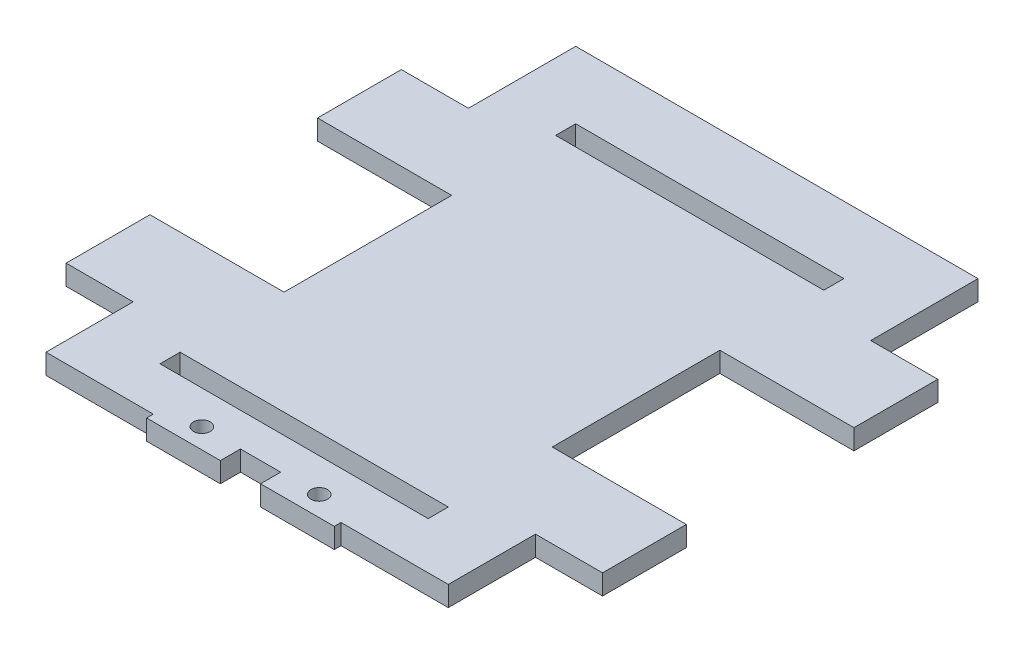
from build123d import *

# Parameters (mm, degrees)
SKETCH1_W           = 40
SKETCH1_H           = 3
BOSS_EXTRUDE1_DEPTH = 3
SKETCH2_R           = 1.25
CUT_EXTRUDE1_DEPTH  = 10
SKETCH3_W           = 16
SKETCH3_H           = 3
SKETCH3_W_2         = 11
SKETCH3_H_2         = 2.000440009
CUT_EXTRUDE2_DEPTH  = 10


with BuildPart() as part:
    # Sketch1 → Boss-Extrude1 (new body)
    with BuildSketch(Plane(origin=(0, 0, 0), x_dir=(1, 0, 0), z_dir=(0, 1, 0))):
        Polygon((20, 37.5), (20, 12.5), (0, 12.5), (0, 0), (10, 0), (10, -16), (70, -16), (70, 0), (80, 0), (80, 12.5), (60, 12.5), (60, 37.5), (80, 37.5), (80, 50), (70, 50), (70, 66), (10, 66), (10, 50), (0, 50), (0, 37.5), align=None)
        with Locations((40, -4.5)):
            Rectangle(SKETCH1_W, SKETCH1_H, mode=Mode.SUBTRACT)
        with Locations((40, 54.5)):
            Rectangle(SKETCH1_W, SKETCH1_H, mode=Mode.SUBTRACT)
    extrude(amount=BOSS_EXTRUDE1_DEPTH)

    # Sketch2 → Cut-Extrude1 (cut)
    with BuildSketch(Plane(origin=(0, 0, 0), x_dir=(1, 0, 0), z_dir=(0, 1, 0))):
        with Locations(Location((31.25, -11, 0), (0, 0, 270))):
            Circle(SKETCH2_R)
        with Locations(Location((48.75, -11, 0), (0, 0, 270))):
            Circle(SKETCH2_R)
    extrude(amount=CUT_EXTRUDE1_DEPTH, mode=Mode.SUBTRACT)

    # Sketch3 → Cut-Extrude2 (cut)
    with BuildSketch(Plane(origin=(0, 0, 0), x_dir=(1, 0, 0), z_dir=(0, 1, 0))):
        with Locations((18, -14.5)):
            Rectangle(SKETCH3_W, SKETCH3_H)
        Polygon((37, -16), (40, -16), (40, -11), (37, -11), (37, -13.999559991), align=None)
        Polygon((40, -11), (40, -16), (43, -16), (43, -13.999559991), (43, -11), align=None)
        with Locations((62, -14.5)):
            Rectangle(SKETCH3_W, SKETCH3_H)
        with Locations((31.5, -14.999779996)):
            Rectangle(SKETCH3_W_2, SKETCH3_H_2)
        with Locations((48.5, -14.999779996)):
            Rectangle(SKETCH3_W_2, SKETCH3_H_2)
    extrude(amount=CUT_EXTRUDE2_DEPTH, mode=Mode.SUBTRACT)


solid = part.part
